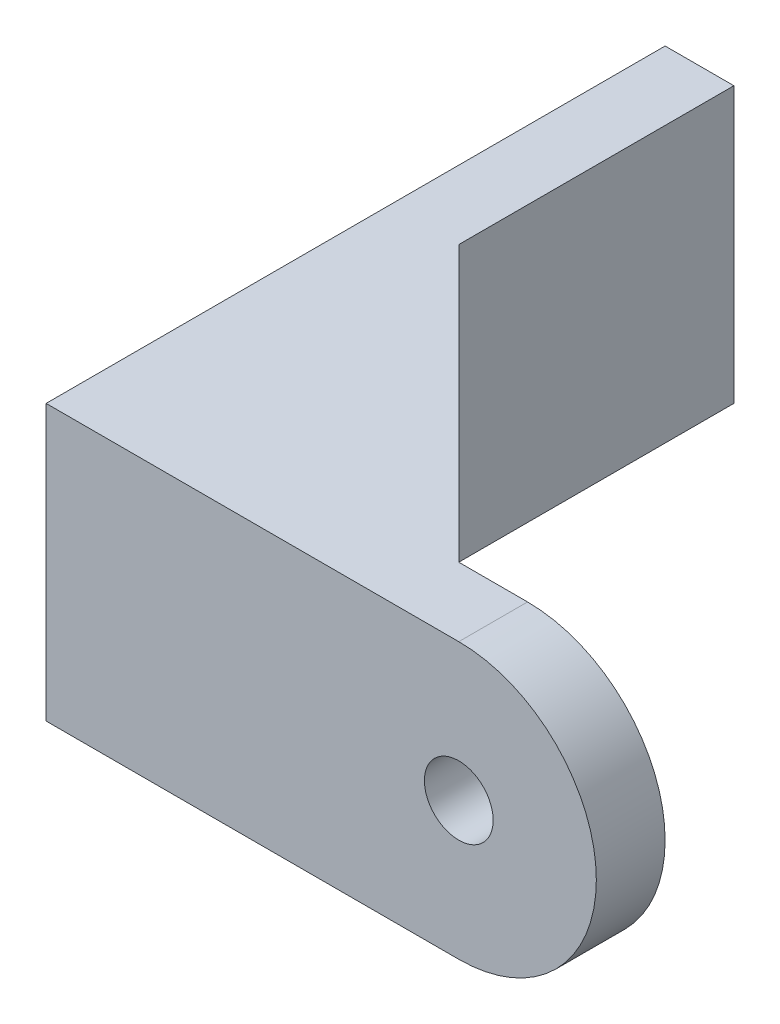
from build123d import *

# Parameters (mm, degrees)
SKETCH1_R           = 2.5
BOSS_EXTRUDE1_DEPTH = 5
SKETCH2_W           = 5
SKETCH2_H           = 20
BOSS_EXTRUDE2_DEPTH = 40
BOSS_EXTRUDE3_DEPTH = 5
BOSS_EXTRUDE4_DEPTH = 5


with BuildPart() as part:
    # Sketch1 → Boss-Extrude1 (new body)
    with BuildSketch(Plane.XY):
        with BuildLine():
            Line((-15, -10), (-15, 10))
            Line((-15, 10), (15, 10))
            ThreePointArc((15, 10), (25, 0), (15, -10))
            Line((15, -10), (-15, -10))
        make_face()
        with Locations((15, 0)):
            Circle(SKETCH1_R, mode=Mode.SUBTRACT)
    extrude(amount=BOSS_EXTRUDE1_DEPTH)

    # Sketch2 → Boss-Extrude2 (add)
    with BuildSketch(Plane(origin=(0, 0, 0), x_dir=(-1, 0, 0), z_dir=(0, 0, -1))):
        with Locations((12.5, 0)):
            Rectangle(SKETCH2_W, SKETCH2_H)
    extrude(amount=BOSS_EXTRUDE2_DEPTH)

    # Sketch4 → Boss-Extrude3 (add)
    with BuildSketch(Plane.XZ.offset(10)):
        Polygon((-10, -20), (10, 0), (-10, 0), align=None)
    extrude(amount=-BOSS_EXTRUDE3_DEPTH)

    # Sketch5 → Boss-Extrude4 (add)
    with BuildSketch(Plane(origin=(0, 10, 0), x_dir=(1, 0, 0), z_dir=(0, 1, 0))):
        Polygon((10, 0), (-10, 20), (-10, 0), align=None)
    extrude(amount=-BOSS_EXTRUDE4_DEPTH)


solid = part.part
